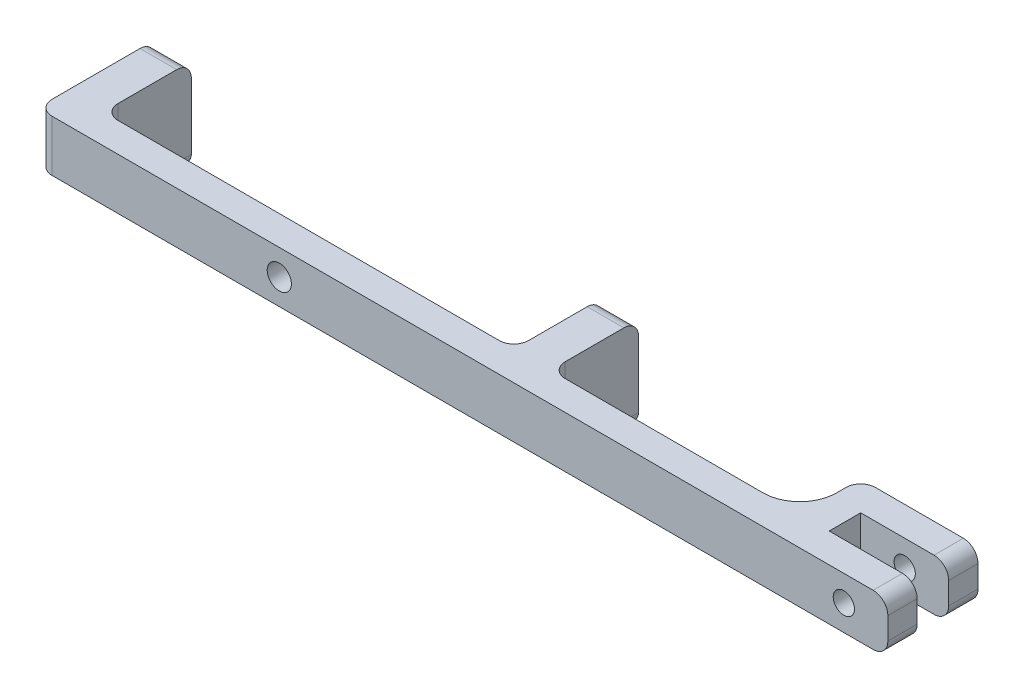
from build123d import *

# Parameters (mm, degrees)
SKETCH1_W               = 66
SKETCH1_H               = 4
BOSS_EXTRUDE1_DEPTH     = 7
SKETCH2_R               = 1.65
CUT_EXTRUDE1_DEPTH      = 67.49060084
SKETCH3_W               = 5
SKETCH3_H               = 3.5
BOSS_EXTRUDE2_DEPTH     = 12
SKETCH4_W               = 5
SKETCH4_H               = 5
BOSS_EXTRUDE3_DEPTH     = 6
SKETCH5_W               = 4
SKETCH5_H               = 7
BOSS_EXTRUDE4_DEPTH     = 50
SKETCH7_W               = 5
SKETCH7_H               = 12
BOSS_EXTRUDE5_DEPTH     = 3.5
FILLET1_R               = 2
FILLET2_R               = 2
SKETCH8_W               = 4
SKETCH8_H               = 7
BOSS_EXTRUDE6_DEPTH     = 8.3
SKETCH9_W               = 4
SKETCH9_H               = 7
BOSS_EXTRUDE7_DEPTH     = 12
CUT_EXTRUDE2_DEPTH      = 117.828934772
CUT_EXTRUDE2_DEPTH_BACK = 117.828934772
SKETCH6_R               = 1.45
FILLET3_R               = 2
FILLET4_R               = 5
FILLET5_R               = 2


with BuildPart() as part:
    # Sketch1 → Boss-Extrude1 (new body)
    with BuildSketch(Plane(origin=(0, 0, 0), x_dir=(1, 0, 0), z_dir=(0, 1, 0))):
        with Locations((33, -2)):
            Rectangle(SKETCH1_W, SKETCH1_H)
    extrude(amount=BOSS_EXTRUDE1_DEPTH)

    # Sketch2 → Cut-Extrude1 (cut, through all)
    with BuildSketch(Plane.XY.offset(4)):
        with Locations((33, 3.5)):
            Circle(SKETCH2_R)
    extrude(amount=-CUT_EXTRUDE1_DEPTH, mode=Mode.SUBTRACT)

    # Sketch3 → Boss-Extrude2 (add)
    with BuildSketch(Plane(origin=(0, 0, 0), x_dir=(-1, 0, 0), z_dir=(0, 0, -1))):
        with Locations((-63.5, 1.75)):
            Rectangle(SKETCH3_W, SKETCH3_H)
        with Locations((-2.5, 1.75)):
            Rectangle(SKETCH3_W, SKETCH3_H)
    extrude(amount=BOSS_EXTRUDE2_DEPTH)

    # Sketch4 → Boss-Extrude3 (add)
    with BuildSketch(Plane(origin=(0, 0, 0), x_dir=(-1, 0, 0), z_dir=(0, -1, 0))):
        with Locations((-63.5, 9.5)):
            Rectangle(SKETCH4_W, SKETCH4_H)
        with Locations((-2.5, 9.5)):
            Rectangle(SKETCH4_W, SKETCH4_H)
    extrude(amount=BOSS_EXTRUDE3_DEPTH)

    # Sketch5 → Boss-Extrude4 (add)
    with BuildSketch(Plane(origin=(66, 0, 0), x_dir=(0, 0, -1), z_dir=(1, 0, 0))):
        with Locations((-2, 3.5)):
            Rectangle(SKETCH5_W, SKETCH5_H)
    extrude(amount=BOSS_EXTRUDE4_DEPTH)

    # Sketch7 → Boss-Extrude5 (add)
    with BuildSketch(Plane(origin=(0, 3.5, 0), x_dir=(1, 0, 0), z_dir=(0, 1, 0))):
        with Locations((63.5, 6)):
            Rectangle(SKETCH7_W, SKETCH7_H)
        with Locations((2.5, 6)):
            Rectangle(SKETCH7_W, SKETCH7_H)
    extrude(amount=BOSS_EXTRUDE5_DEPTH)

    # Fillet1
    fillet1_edges = [part.edges().sort_by_distance(p)[0] for p in [
        (66, -6, -9.5),
        (63.5, -6, -7),
        (61, -6, -9.5),
        (63.5, -6, -12),
        (5, -6, -9.5),
        (2.5, -6, -7),
        (0, -6, -9.5),
        (2.5, -6, -12),
    ]]
    fillet(fillet1_edges, radius=FILLET1_R)

    # Fillet2
    fillet2_edges = [part.edges().sort_by_distance(p)[0] for p in [
        (61, 3.5, 0),
        (5, 3.5, 0),
        (63.5, 0, -7),
        (2.5, 0, -7),
        (66, 3.5, 0),
        (116, 0, 2),
        (116, 7, 2),
        (0, 3.5, 4),
        (63.5, 7, -12),
        (2.5, 7, -12),
    ]]
    fillet(fillet2_edges, radius=FILLET2_R)

    # Sketch8 → Boss-Extrude6 (add)
    with BuildSketch(Plane(origin=(0, 0, 0), x_dir=(-1, 0, 0), z_dir=(0, 0, -1))):
        with Locations((-102, 3.5)):
            Rectangle(SKETCH8_W, SKETCH8_H)
    extrude(amount=BOSS_EXTRUDE6_DEPTH)

    # Sketch9 → Boss-Extrude7 (add)
    with BuildSketch(Plane(origin=(104, 0, 0), x_dir=(0, 0, -1), z_dir=(1, 0, 0))):
        with Locations((6.3, 3.5)):
            Rectangle(SKETCH9_W, SKETCH9_H)
    extrude(amount=BOSS_EXTRUDE7_DEPTH)

    # Sketch6 → Cut-Extrude2 (cut, two sides: drawn at the far end of the back side and taken through both)
    with BuildSketch(Plane(origin=(0, 0, 0), x_dir=(-1, 0, 0), z_dir=(0, 0, -1)).offset(-CUT_EXTRUDE2_DEPTH_BACK)):
        with Locations((-110, 3.5)):
            Circle(SKETCH6_R)
    extrude(amount=CUT_EXTRUDE2_DEPTH + CUT_EXTRUDE2_DEPTH_BACK, mode=Mode.SUBTRACT)

    # Fillet3
    fillet3_edges = [part.edges().sort_by_distance(p)[0] for p in [
        (116, 7, -6.3),
        (116, 0, -6.3),
    ]]
    fillet(fillet3_edges, radius=FILLET3_R)

    # Fillet4
    fillet4_edges = [part.edges().sort_by_distance(p)[0] for p in [
        (100, 3.5, 0),
    ]]
    fillet(fillet4_edges, radius=FILLET4_R)

    # Fillet5
    fillet5_edges = [part.edges().sort_by_distance(p)[0] for p in [
        (100, 3.5, -8.3),
    ]]
    fillet(fillet5_edges, radius=FILLET5_R)


solid = part.part
